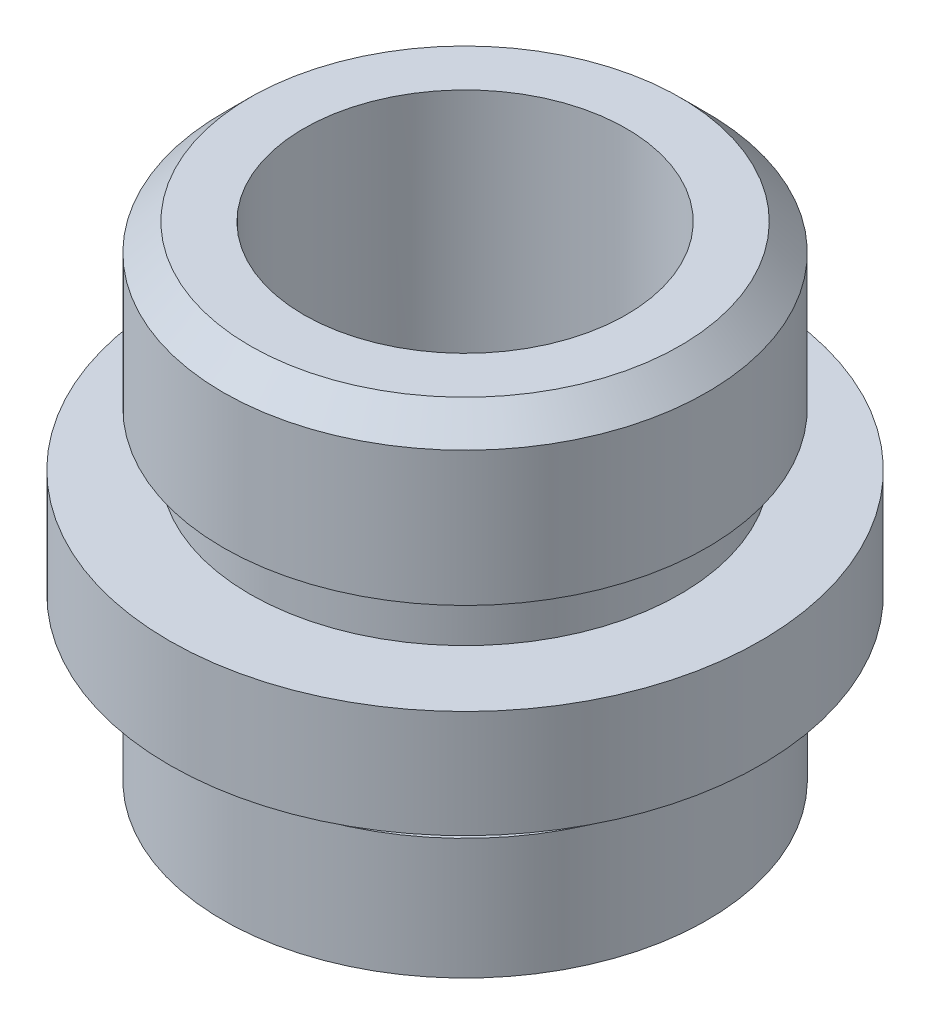
from build123d import *

# Parameters (mm, degrees)
BOSS_EXTRUDE1_DEPTH      = 4
BOSS_EXTRUDE1_DEPTH_BACK = 4
SKETCH1_R                = 22
SKETCH2_R                = 16
BOSS_EXTRUDE2_DEPTH      = 4
SKETCH3_R                = 18
BOSS_EXTRUDE3_DEPTH      = 12
BOSS_EXTRUDE4_START      = 3
SKETCH4_R                = 16
BOSS_EXTRUDE4_DEPTH      = 3
BOSS_EXTRUDE5_START      = 9
SKETCH5_R                = 18
BOSS_EXTRUDE5_DEPTH      = 9
CHAMFER1_SIZE            = 2
SKETCH6_R                = 12
CUT_EXTRUDE1_DEPTH       = 36


with BuildPart() as part:
    # Sketch1 → Boss-Extrude1 (new, two sides: drawn at the far end of the back side and taken through both)
    with BuildSketch(Plane(origin=(0, 0, 0), x_dir=(1, 0, 0), z_dir=(0, 1, 0)).offset(-BOSS_EXTRUDE1_DEPTH_BACK)):
        with Locations(Location((0, 0, 0), (0, 0, 270))):
            Circle(SKETCH1_R)
    extrude(amount=BOSS_EXTRUDE1_DEPTH + BOSS_EXTRUDE1_DEPTH_BACK)

    # Sketch2 → Boss-Extrude2 (add)
    with BuildSketch(Plane(origin=(0, 4, 0), x_dir=(1, 0, 0), z_dir=(0, 1, 0))):
        with Locations(Location((0, 0, 0), (0, 0, 270))):
            Circle(SKETCH2_R)
    extrude(amount=BOSS_EXTRUDE2_DEPTH)

    # Sketch3 → Boss-Extrude3 (add)
    with BuildSketch(Plane(origin=(0, 8, 0), x_dir=(1, 0, 0), z_dir=(0, 1, 0))):
        with Locations(Location((0, 0, 0), (0, 0, 270))):
            Circle(SKETCH3_R)
    extrude(amount=BOSS_EXTRUDE3_DEPTH)

    # Sketch4 → Boss-Extrude4 (add)
    with BuildSketch(Plane.XZ.offset(4).offset(BOSS_EXTRUDE4_START)):
        with Locations(Location((0, 0, 0), (0, 0, 90))):
            Circle(SKETCH4_R)
    extrude(amount=-BOSS_EXTRUDE4_DEPTH)

    # Sketch5 → Boss-Extrude5 (add)
    with BuildSketch(Plane.XZ.offset(7).offset(BOSS_EXTRUDE5_START)):
        with Locations(Location((0, 0, 0), (0, 0, 90))):
            Circle(SKETCH5_R)
    extrude(amount=-BOSS_EXTRUDE5_DEPTH)

    # Chamfer1
    chamfer1_edges = [part.edges().sort_by_distance(p)[0] for p in [
        (0, 20, -18),
    ]]
    chamfer(chamfer1_edges, length=CHAMFER1_SIZE)

    # Sketch6 → Cut-Extrude1 (cut)
    with BuildSketch(Plane(origin=(0, 20, 0), x_dir=(1, 0, 0), z_dir=(0, 1, 0))):
        with Locations(Location((0, 0, 0), (0, 0, 270))):
            Circle(SKETCH6_R)
    extrude(amount=-CUT_EXTRUDE1_DEPTH, mode=Mode.SUBTRACT)


solid = part.part
